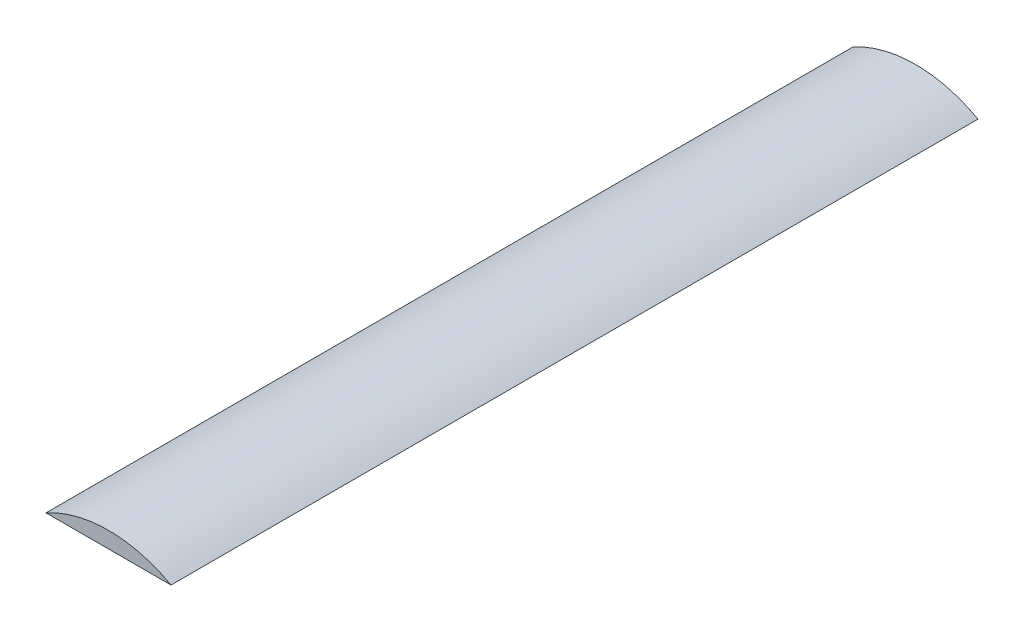
from build123d import *

# Parameters (mm, degrees)
EXTRUDE_1_DEPTH = 100


with BuildPart() as part:
    # 草图1 → 凸台-拉伸1 (new body)
    with BuildSketch(Plane.XY):
        with BuildLine():
            Line((5, 1), (-2.745966692, 1))
            ThreePointArc((-2.745966692, 1), (5, 3), (12.745966692, 1))
            Line((12.745966692, 1), (5, 1))
        make_face()
    extrude(amount=EXTRUDE_1_DEPTH)


solid = part.part
